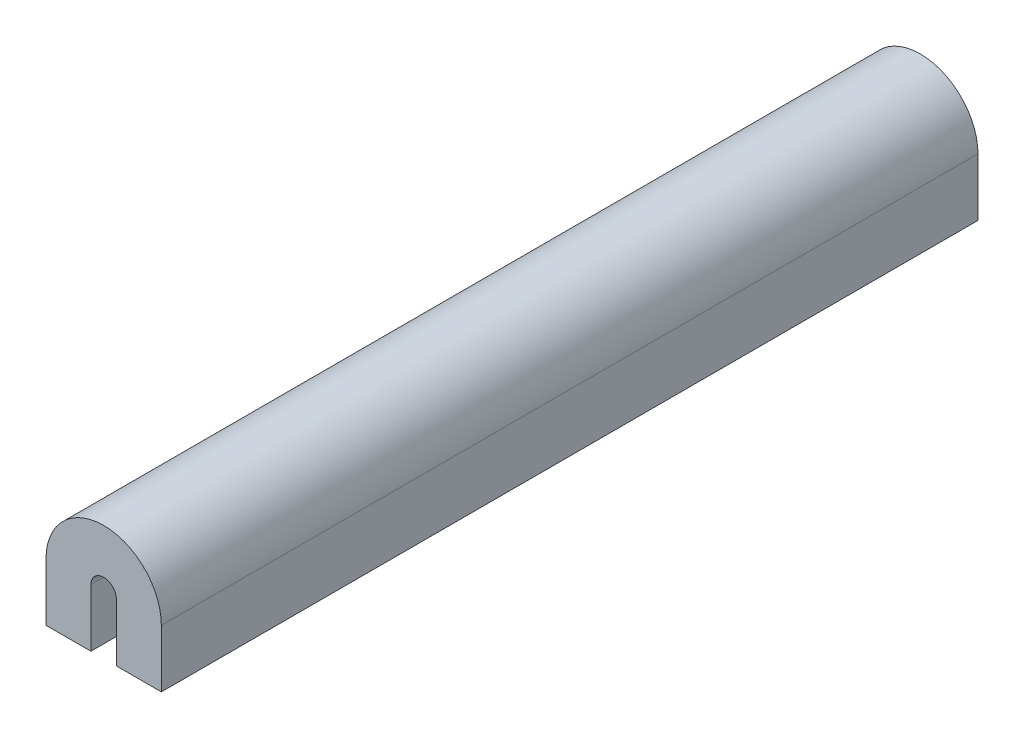
from build123d import *

# Parameters (mm, degrees)
BOSS_EXTRUDE1_DEPTH = 101.6


with BuildPart() as part:
    # Sketch1 → Boss-Extrude1 (new body)
    with BuildSketch(Plane.XY):
        with BuildLine():
            Line((-1.5875, 0), (-1.5875, -7.1755))
            Line((-1.5875, -7.1755), (-7.1755, -7.1755))
            Line((-7.1755, -7.1755), (-7.1755, 0))
            ThreePointArc((-7.1755, 0), (0, 7.1755), (7.1755, 0))
            Line((7.1755, 0), (7.1755, -7.1755))
            Line((7.1755, -7.1755), (1.5875, -7.1755))
            Line((1.5875, -7.1755), (1.5875, 0))
            ThreePointArc((1.5875, 0), (0, 1.5875), (-1.5875, 0))
        make_face()
    extrude(amount=BOSS_EXTRUDE1_DEPTH)


solid = part.part
